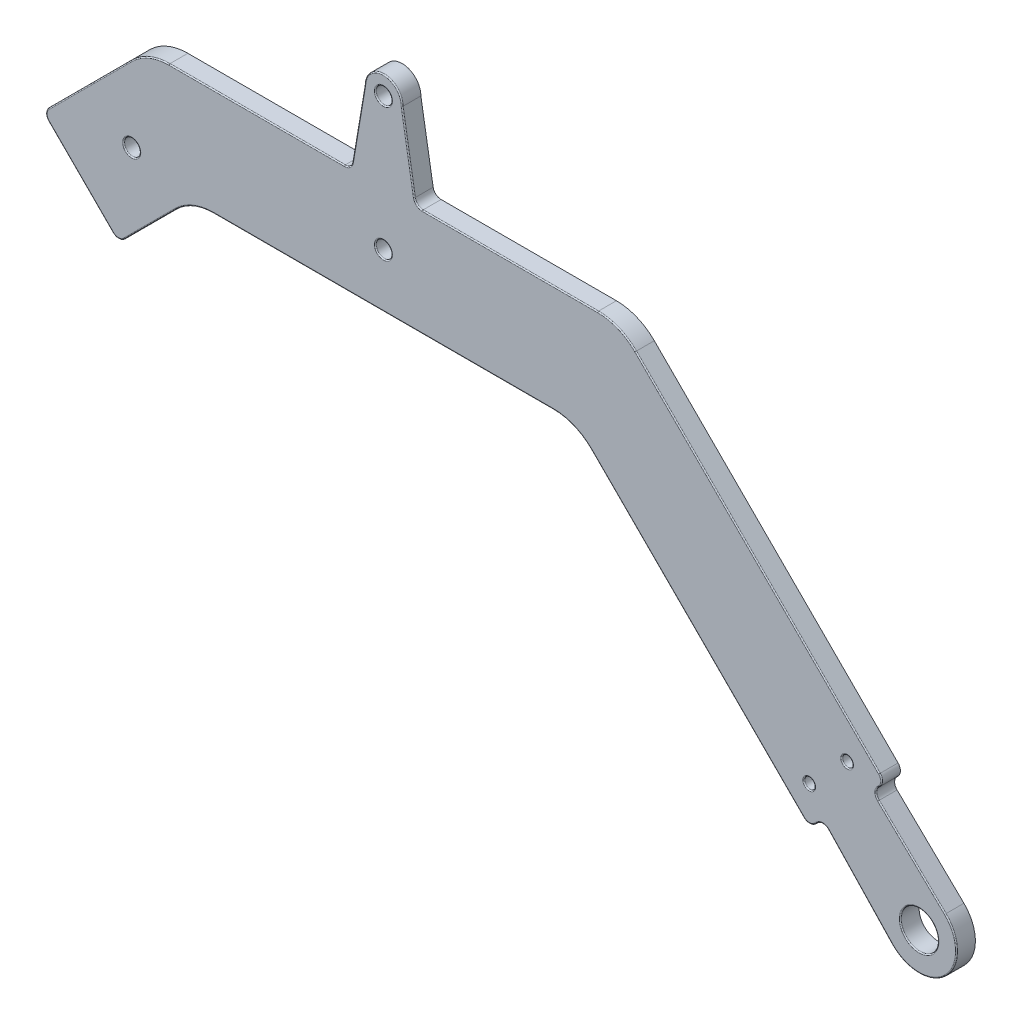
from build123d import *

# Parameters (mm, degrees)
SKETCH5_R           = 3.5
SKETCH5_R_2         = 1.5
SKETCH5_R_3         = 1
BOSS_EXTRUDE1_DEPTH = 3.5
FILLET1_R           = 10
FILLET2_R           = 1.5
FILLET3_R           = 0.2


with BuildPart() as part:
    # Sketch5 → Boss-Extrude1 (new body)
    with BuildSketch(Plane.XY):
        with BuildLine():
            Line((-2.53072393, 84.85), (-0.03072393, 70))
            Line((-0.03072393, 70), (38.111411694, 70))
            Line((38.111411694, 70), (87.60531504, 20.506096654))
            Line((87.60531504, 20.506096654), (85.263576648, 18.164358262))
            Line((85.263576648, 18.164358262), (98.836910948, 5.030519924))
            ThreePointArc((98.836910948, 5.030519924), (98.889532253, -4.979064078), (88.881279899, -4.807524827))
            Line((88.881279899, -4.807524827), (76.014287219, 8.810129133))
            Line((76.014287219, 8.810129133), (73.463179416, 6.363961031))
            Line((73.463179416, 6.363961031), (29.827140447, 50))
            Line((29.827140447, 50), (-41.888588306, 50))
            Line((-41.888588306, 50), (-55.476160412, 36.412427894))
            Line((-55.476160412, 36.412427894), (-69.618296036, 50.554563517))
            Line((-69.618296036, 50.554563517), (-50.172859553, 70))
            Line((-50.172859553, 70), (-12.03072393, 70))
            Line((-12.03072393, 70), (-9.53072393, 84.85))
            ThreePointArc((-9.53072393, 84.85), (-6.03072393, 88.35), (-2.53072393, 84.85))
        make_face()
        with Locations((93.96927607, 0)):
            Circle(SKETCH5_R, mode=Mode.SUBTRACT)
        with Locations((-53.015361965, 53.015361965)):
            Circle(SKETCH5_R_2, mode=Mode.SUBTRACT)
        with Locations((-6.03072393, 84.85)):
            Circle(SKETCH5_R_2, mode=Mode.SUBTRACT)
        with Locations((-6.03072393, 60)):
            Circle(SKETCH5_R_2, mode=Mode.SUBTRACT)
        with Locations((80.534247228, 20.506096654)):
            Circle(SKETCH5_R_3, mode=Mode.SUBTRACT)
        with Locations((73.463179416, 13.435028843)):
            Circle(SKETCH5_R_3, mode=Mode.SUBTRACT)
    extrude(amount=BOSS_EXTRUDE1_DEPTH)

    # Fillet1
    fillet1_edges = [part.edges().sort_by_distance(p)[0] for p in [
        (29.827140447, 50, 1.75),
        (-41.888588306, 50, 1.75),
        (-50.172859553, 70, 1.75),
        (38.111411694, 70, 1.75),
    ]]
    fillet(fillet1_edges, radius=FILLET1_R)

    # Fillet2
    fillet2_edges = [part.edges().sort_by_distance(p)[0] for p in [
        (76.014287219, 8.810129133, 1.75),
        (73.463179416, 6.363961031, 1.75),
        (-55.476160412, 36.412427894, 1.75),
        (-69.618296036, 50.554563517, 1.75),
        (-12.03072393, 70, 1.75),
        (-0.03072393, 70, 1.75),
        (87.60531504, 20.506096654, 1.75),
        (85.263576648, 18.164358262, 1.75),
    ]]
    fillet(fillet2_edges, radius=FILLET2_R)

    # Fillet3
    fillet3_edges = [part.edges().sort_by_distance(p)[0] for p in [
        (-62.547228224, 43.483495706, 3.5),
        (-29.665015214, 70, 3.5),
        (74.723496899, 7.572435413, 3.5),
        (82.966669902, 1.452143944, 3.5),
        (86.443244813, 19.344026427, 3.5),
        (63.792499375, 44.318912319, 3.5),
        (-1.386025187, 78.050489471, 3.5),
        (86.983994696, 20.506096654, 3.5),
        (73.469471855, 6.963324661, 3.5),
        (-68.996975692, 50.554563517, 3.5),
        (-55.476160412, 37.033748237, 3.5),
        (-12.330681593, 70.354676555, 3.5),
        (0.269233734, 70.354676555, 3.5),
        (75.998770238, 8.181172538, 3.5),
        (85.902545695, 18.169615377, 3.5),
        (-6.03072393, 88.35, 3.5),
        (-10.675422672, 78.050489471, 3.5),
        (90.46927607, 0, 3.5),
        (-54.515361965, 53.015361965, 3.5),
        (-7.53072393, 84.85, 3.5),
        (98.889532253, -4.979064078, 3.5),
        (-7.53072393, 60, 3.5),
        (79.534247228, 20.506096654, 3.5),
        (72.463179416, 13.435028843, 3.5),
        (52.590315625, 27.236824822, 3.5),
        (-6.03072393, 50, 3.5),
        (-60.829713803, 59.343145751, 3.5),
        (17.603567355, 70, 3.5),
        (37.796110394, 69.238795325, 3.5),
        (-49.857558253, 69.238795325, 3.5),
        (29.511839147, 49.238795325, 3.5),
        (-41.573287006, 49.238795325, 3.5),
        (92.59817063, 11.067253784, 3.5),
        (-49.616510367, 42.272077939, 3.5),
    ]]
    fillet(fillet3_edges, radius=FILLET3_R)


solid = part.part
